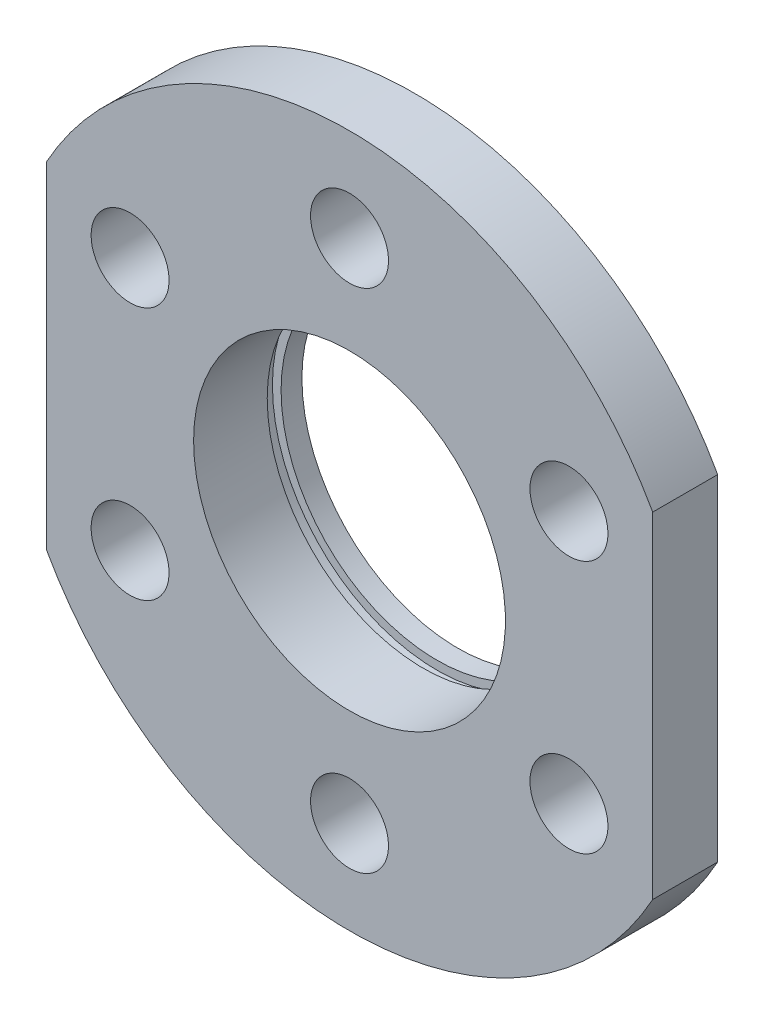
from build123d import *

# Parameters (mm, degrees)
F_9_0_9_DIAMETER_HOLE1_D = 9
CIRPATTERN1_COUNT        = 6
CHAMFER1_SIZE            = 1
EXTRUDE1_DEPTH           = 58.933971161


with BuildPart() as part:
    # Sketch1 → Revolve1 (revolve)
    with BuildSketch(Plane(origin=(0, 0, 0), x_dir=(0, 0, -1), z_dir=(1, 0, 0)), mode=Mode.PRIVATE) as revolve1_sk:
        Polygon((0, 18), (8.5, 18), (8.5, 19), (10.1, 19), (10.1, 18), (12.5038, 18), (12.5038, 23.5), (7.5, 23.5), (7.5, 40), (0, 40), align=None)
    revolve(revolve1_sk.sketch.rotate(Axis((0, 0, -13.627513848), (0, 0, 1)), 90), axis=Axis((0, 0, -13.627513848), (0, 0, 1)))

    # Ø9.0 (9) Diameter Hole1 (through all)
    with Locations(Plane(origin=(0, 0, -7.5), x_dir=(-1, 0, 0), z_dir=(0, 0, -1))):
        with Locations((0, 29.25)):
            f_9_0_9_diameter_hole1 = Hole(F_9_0_9_DIAMETER_HOLE1_D / 2)

    # CirPattern1: Ø9.0 (9) Diameter Hole1 ×6 about axis
    cirpattern1_axis = Axis((0, 0, 0), (0, 0, 1))
    for i in range(1, CIRPATTERN1_COUNT):
        add(f_9_0_9_diameter_hole1.rotate(cirpattern1_axis, i * 360 / CIRPATTERN1_COUNT), mode=Mode.SUBTRACT)

    # Chamfer1
    chamfer1_edges = [part.edges().sort_by_distance(p)[0] for p in [
        (23.5, 0, -12.5038),
    ]]
    chamfer(chamfer1_edges, length=CHAMFER1_SIZE)

    # Sketch4 → Extrude1 (cut, through all)
    with BuildSketch(Plane.XY):
        with BuildLine():
            Line((-35, 19.364916731), (-35, -19.364916731))
            ThreePointArc((-35, -19.364916731), (-40, 0), (-35, 19.364916731))
        make_face()
        with BuildLine():
            Line((35, 19.364916731), (35, -19.364916731))
            ThreePointArc((35, -19.364916731), (40, 0), (35, 19.364916731))
        make_face()
    extrude(amount=-EXTRUDE1_DEPTH, mode=Mode.SUBTRACT)


solid = part.part
